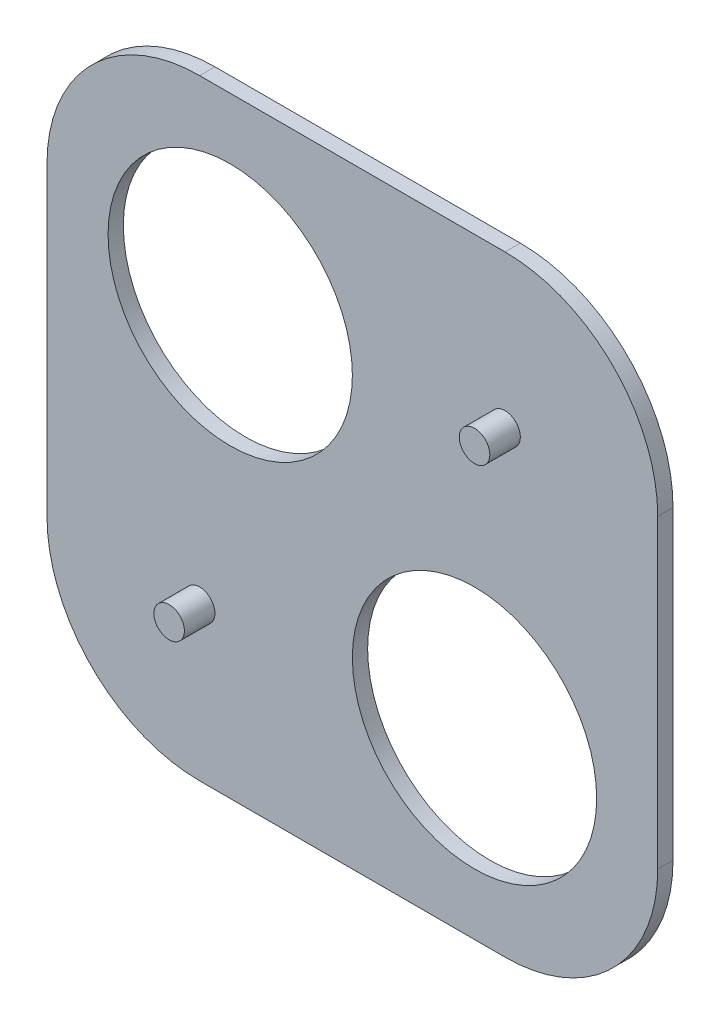
from build123d import *

# Parameters (mm, degrees)
BOSS_EXTRUDE1_DEPTH = 50
SKETCH2_R           = 50
BOSS_EXTRUDE2_DEPTH = 100
SKETCH3_R           = 400
CUT_EXTRUDE1_DEPTH  = 100


with BuildPart() as part:
    # Sketch1 → Boss-Extrude1 (new body)
    with BuildSketch(Plane.XY):
        with BuildLine():
            Line((-500, 1000), (500, 1000))
            ThreePointArc((500, 1000), (853.553390593, 853.553390593), (1000, 500))
            Line((1000, 500), (1000, -500))
            ThreePointArc((1000, -500), (853.553390593, -853.553390593), (500, -1000))
            Line((500, -1000), (-500, -1000))
            ThreePointArc((-500, -1000), (-853.553390593, -853.553390593), (-1000, -500))
            Line((-1000, -500), (-1000, 500))
            ThreePointArc((-1000, 500), (-853.553390593, 853.553390593), (-500, 1000))
        make_face()
    extrude(amount=BOSS_EXTRUDE1_DEPTH)

    # Sketch2 → Boss-Extrude2 (add)
    with BuildSketch(Plane.XY.offset(50)):
        with Locations(Location((-500, -500, 0), (0, 0, 180))):
            Circle(SKETCH2_R)
        with Locations(Location((500, 500, 0), (0, 0, 180))):
            Circle(SKETCH2_R)
    extrude(amount=BOSS_EXTRUDE2_DEPTH)

    # Sketch3 → Cut-Extrude1 (cut)
    with BuildSketch(Plane.XY.offset(50)):
        with Locations((400, -400)):
            Circle(SKETCH3_R)
        with Locations((-400, 400)):
            Circle(SKETCH3_R)
    extrude(amount=-CUT_EXTRUDE1_DEPTH, mode=Mode.SUBTRACT)


solid = part.part
